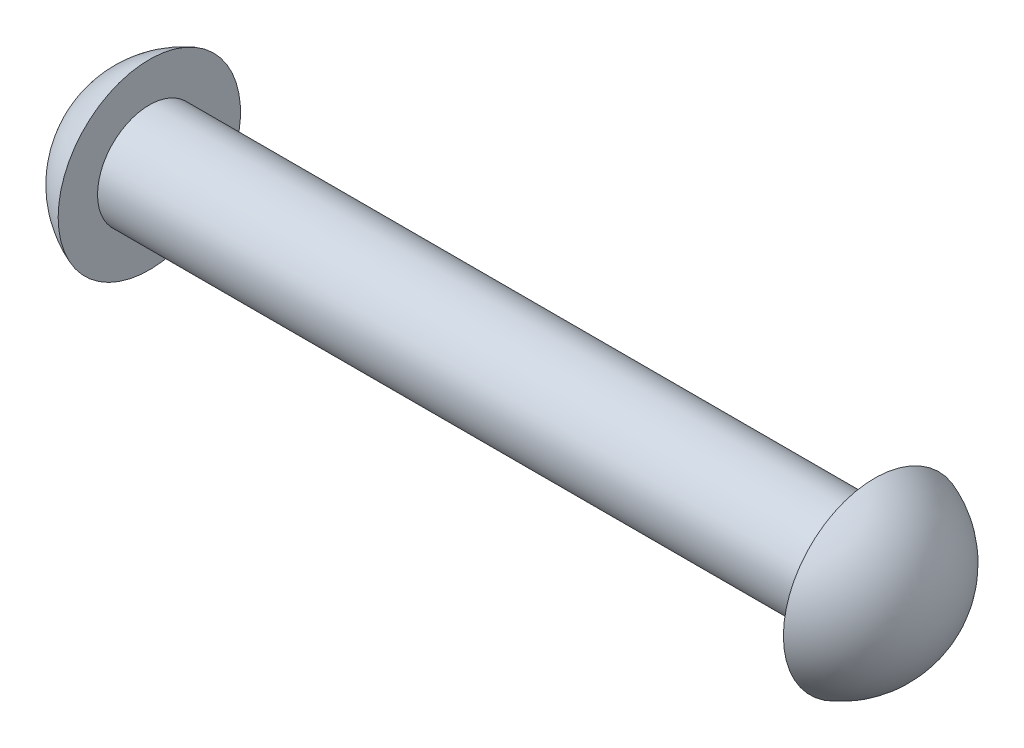
from build123d import *


with BuildPart() as part:
    # Sketch1 → Base-Revolve (revolve)
    with BuildSketch(Plane.XY, mode=Mode.PRIVATE) as base_revolve_sk:
        with BuildLine():
            Line((-38, 0), (0, 0))
            Line((0, 0), (0, 2.5))
            Line((0, 2.5), (-35, 2.5))
            Line((-35, 2.5), (-35, 4.4))
            ThreePointArc((-35, 4.4), (-37.201467124, 2.678273039), (-38, 0))
        make_face()
    revolve(base_revolve_sk.sketch.rotate(Axis((-39, 0, 0), (1, 0, 0)), 90), axis=Axis((-39, 0, 0), (1, 0, 0)))

    # Sketch3 → HeadTypeA (revolve)
    with BuildSketch(Plane.XY):
        with BuildLine():
            Line((0, 0), (3, 0))
            ThreePointArc((3, 0), (2.201467124, 2.678273039), (0, 4.4))
            Line((0, 4.4), (0, 0))
        make_face()
    revolve(axis=Axis((-49, 0, 0), (1, 0, 0)))


solid = part.part
